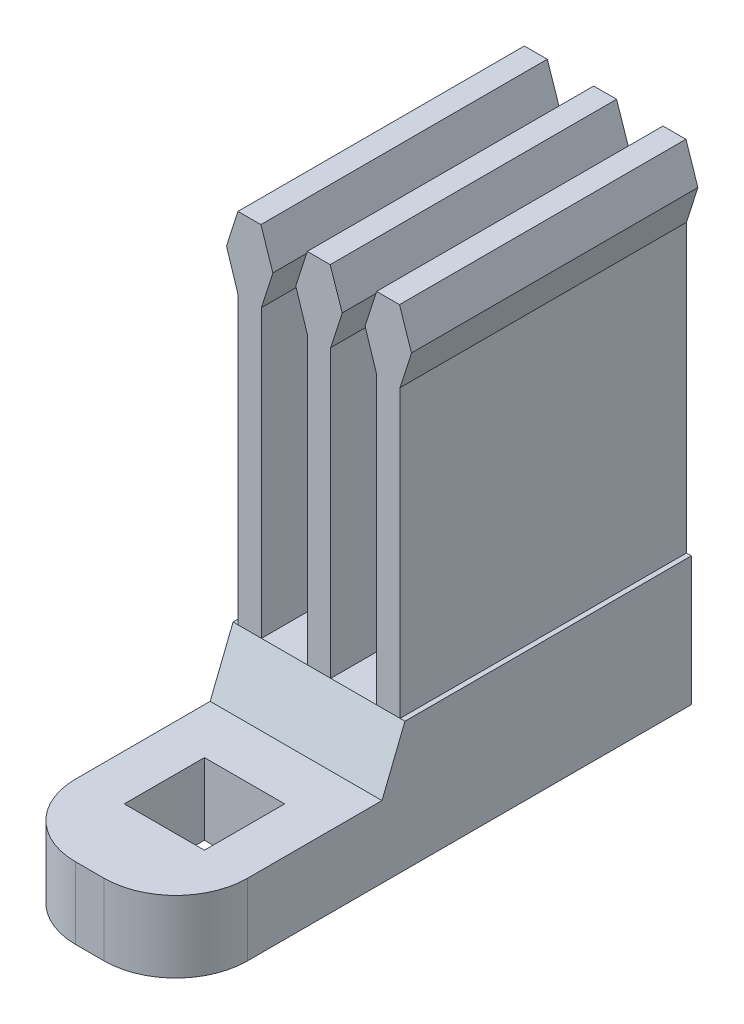
from build123d import *

# Parameters (mm, degrees)
RESSALTO_EXTRUS_O1_DEPTH   = 10
ESBO_O2_W                  = 6
ESBO_O2_H                  = 2.5
RESSALTO_EXTRUS_O2_DEPTH   = 8
ESBO_O3_W                  = 2.8
ESBO_O3_H                  = 2.8
CORTE_EXTRUS_O1_DEPTH      = 25.104680044
ESBO_O4_W                  = 6
ESBO_O4_H                  = 18
ESBO_O4_W_2                = 2.8
ESBO_O4_H_2                = 2.8
RESSALTO_EXTRUS_O3_DEPTH   = 2
CORTE_EXTRUS_O3_DEPTH      = 23.633727046
CORTE_EXTRUS_O3_DEPTH_BACK = 23.633727046
CORTE_EXTRUS_O4_DEPTH      = 24.796756081


with BuildPart() as part:
    # Esboço1 → Ressalto-extrusão1 (new body)
    with BuildSketch(Plane.XY):
        Polygon((-0.4, 0), (-0.57, 0), (-0.57, -2.5), (5.43, -2.5), (5.43, 0), (5.26, 0), (5.26, 10), (5.66, 11.25), (5.24, 12.5), (4.44, 12.5), (4.04, 11.25), (4.44, 10), (4.44, 0), (2.84, 0), (2.84, 10), (3.24, 11.25), (2.82, 12.5), (2.02, 12.5), (1.62, 11.25), (2.02, 10), (2.02, 0), (0.42, 0), (0.42, 10), (0.82, 11.25), (0.4, 12.5), (-0.4, 12.5), (-0.8, 11.25), (-0.4, 10), align=None)
    extrude(amount=RESSALTO_EXTRUS_O1_DEPTH)

    # Esboço2 → Ressalto-extrusão2 (add)
    with BuildSketch(Plane.XY.offset(10)):
        with Locations((2.43, -1.25)):
            Rectangle(ESBO_O2_W, ESBO_O2_H)
    extrude(amount=RESSALTO_EXTRUS_O2_DEPTH)

    # Esboço3 → Corte-extrusão1 (cut, through all)
    with BuildSketch(Plane.XZ.offset(2.5)):
        with Locations((2.43, 14)):
            Rectangle(ESBO_O3_W, ESBO_O3_H)
    extrude(amount=-CORTE_EXTRUS_O1_DEPTH, mode=Mode.SUBTRACT)

    # Esboço4 → Ressalto-extrusão3 (add)
    with BuildSketch(Plane.XZ.offset(2.5)):
        with Locations((2.43, 9)):
            Rectangle(ESBO_O4_W, ESBO_O4_H)
        with Locations((2.43, 14)):
            Rectangle(ESBO_O4_W_2, ESBO_O4_H_2, mode=Mode.SUBTRACT)
    extrude(amount=RESSALTO_EXTRUS_O3_DEPTH)

    # Esboço6 → Corte-extrusão3 (cut, two sides: drawn at the far end of the back side and taken through both)
    with BuildSketch(Plane(origin=(0, 0, 0), x_dir=(0, 0, -1), z_dir=(1, 0, 0)).offset(-CORTE_EXTRUS_O3_DEPTH_BACK)):
        Polygon((-18, 0), (-18, -2), (-14, -2), (-10.8, -2), (-10, 0), align=None)
    extrude(amount=CORTE_EXTRUS_O3_DEPTH + CORTE_EXTRUS_O3_DEPTH_BACK, mode=Mode.SUBTRACT)

    # Esboço7 → Corte-extrusão4 (cut, through all)
    with BuildSketch(Plane(origin=(0, -2, 0), x_dir=(1, 0, 0), z_dir=(0, 1, 0))):
        with BuildLine():
            Line((-0.57, -15.5), (-3.321312229, -15.5))
            Line((-3.321312229, -15.5), (-3.321312229, -18.857639181))
            Line((-3.321312229, -18.857639181), (8.546861735, -18.857639181))
            Line((8.546861735, -18.857639181), (8.546861735, -15.5))
            Line((8.546861735, -15.5), (5.43, -15.5))
            ThreePointArc((5.43, -15.5), (4.697766953, -17.267766953), (2.93, -18))
            Line((2.93, -18), (1.93, -18))
            ThreePointArc((1.93, -18), (0.162233047, -17.267766953), (-0.57, -15.5))
        make_face()
    extrude(amount=-CORTE_EXTRUS_O4_DEPTH, mode=Mode.SUBTRACT)


solid = part.part
